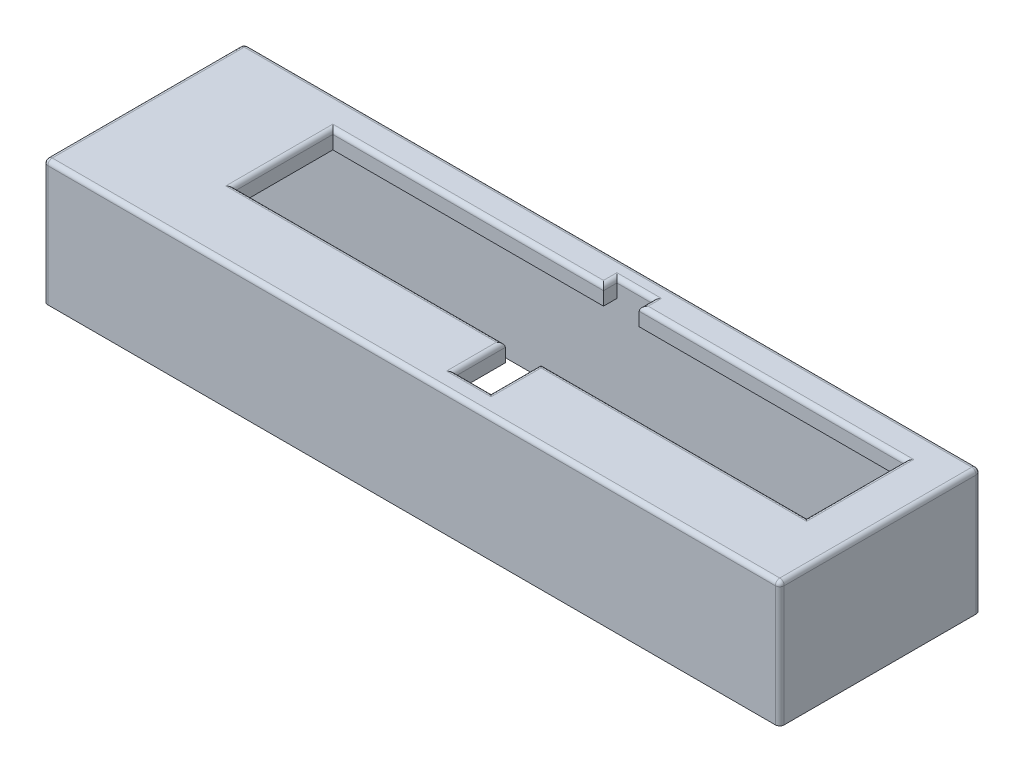
from build123d import *

# Parameters (mm, degrees)
SKETCH1_W           = 209.55
SKETCH1_H           = 57.15
BOSS_EXTRUDE1_DEPTH = 5.08
SKETCH2_W           = 209.55
SKETCH2_H           = 57.15
SKETCH2_W_2         = 199.39
SKETCH2_H_2         = 46.99
BOSS_EXTRUDE2_DEPTH = 30.48
CUT_EXTRUDE2_REACH  = 117.837
FILLET1_R           = 1.27


with BuildPart() as part:
    # Sketch1 → Boss-Extrude1 (new body)
    with BuildSketch(Plane(origin=(0, 0, 0), x_dir=(1, 0, 0), z_dir=(0, 1, 0))):
        with Locations((0, -5.715)):
            Rectangle(SKETCH1_W, SKETCH1_H)
    extrude(amount=BOSS_EXTRUDE1_DEPTH)

    # Sketch2 → Boss-Extrude2 (add)
    with BuildSketch(Plane.XZ):
        with Locations((0, 5.715)):
            Rectangle(SKETCH2_W, SKETCH2_H)
        with Locations((0, 5.715)):
            Rectangle(SKETCH2_W_2, SKETCH2_H_2, mode=Mode.SUBTRACT)
    extrude(amount=BOSS_EXTRUDE2_DEPTH)

    # Sketch3 → Cut-Extrude2 (cut, up to next)
    with BuildSketch(Plane(origin=(0, 5.08, 0), x_dir=(1, 0, 0), z_dir=(0, 1, 0)), mode=Mode.PRIVATE) as cut_extrude2_sk1:
        Polygon((6.35, 13.97), (-70.668502474, 13.97), (-70.668502474, -13.97), (6.35, -13.97), (6.35, -28.17903858), (16.51, -28.17903858), (16.51, -13.97), (92.086948761, -13.97), (92.086948761, 13.97), (16.51, 13.97), (16.51, 17.78), (6.35, 17.78), align=None)
    cut_extrude2_tool1 = extrude(cut_extrude2_sk1.sketch, amount=-CUT_EXTRUDE2_REACH, mode=Mode.PRIVATE) & part.part
    add(cut_extrude2_tool1.solids().sort_by_distance((10.737118, 5.08, 0.513245))[0], mode=Mode.SUBTRACT)

    # Fillet1
    fillet1_edges = [part.edges().sort_by_distance(p)[0] for p in [
        (-104.775, 5.08, 5.715),
        (0, 5.08, 34.29),
        (92.086948761, 5.08, 0),
        (-70.668502474, 5.08, 0),
        (-32.159251237, 5.08, 13.97),
        (6.35, 5.08, 21.07451929),
        (11.43, 5.08, 28.17903858),
        (54.29847438, 5.08, 13.97),
        (104.775, 5.08, 5.715),
        (16.51, 5.08, -15.875),
        (-32.159251237, 5.08, -13.97),
        (54.29847438, 5.08, -13.97),
        (16.51, 5.08, 21.07451929),
        (11.43, 5.08, -17.78),
        (6.35, 5.08, -15.875),
        (104.775, -12.7, 34.29),
        (-104.775, -12.7, 34.29),
        (-104.775, -12.7, -22.86),
        (104.775, -12.7, -22.86),
        (0, 5.08, -22.86),
    ]]
    fillet(fillet1_edges, radius=FILLET1_R)


solid = part.part
